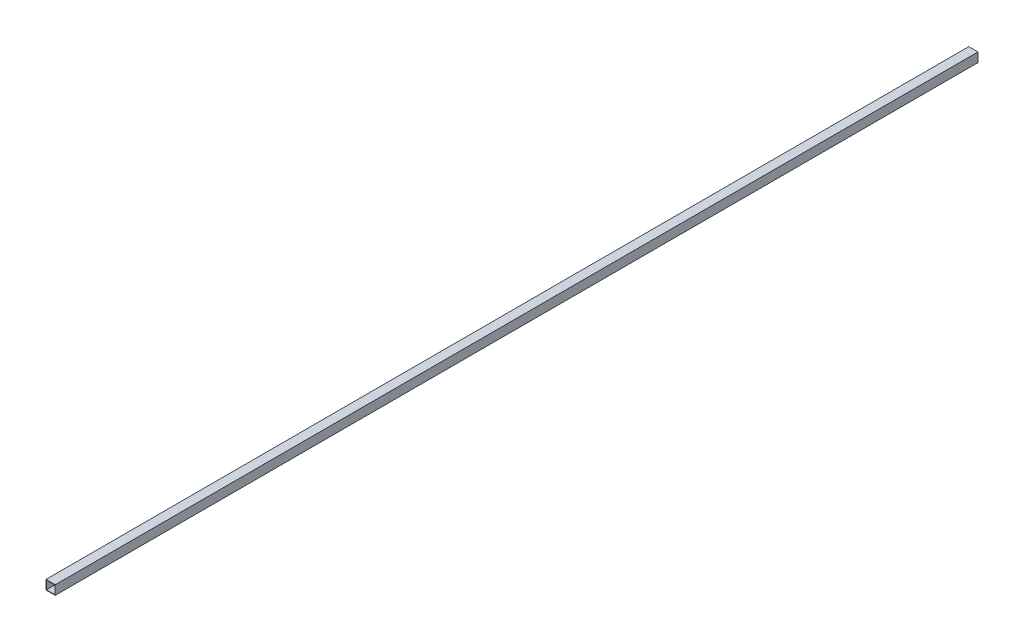
from build123d import *

# Parameters (mm, degrees)
ESQUISSE1_W        = 1000
ESQUISSE1_H        = 1000
ESQUISSE1_W_2      = 900
ESQUISSE1_H_2      = 900
BOSS_EXTRU_1_DEPTH = 100000


with BuildPart() as part:
    # Esquisse1 → Boss.-Extru.1 (new body)
    with BuildSketch(Plane.XY):
        Rectangle(ESQUISSE1_W, ESQUISSE1_H)
        Rectangle(ESQUISSE1_W_2, ESQUISSE1_H_2, mode=Mode.SUBTRACT)
    extrude(amount=BOSS_EXTRU_1_DEPTH)


solid = part.part
